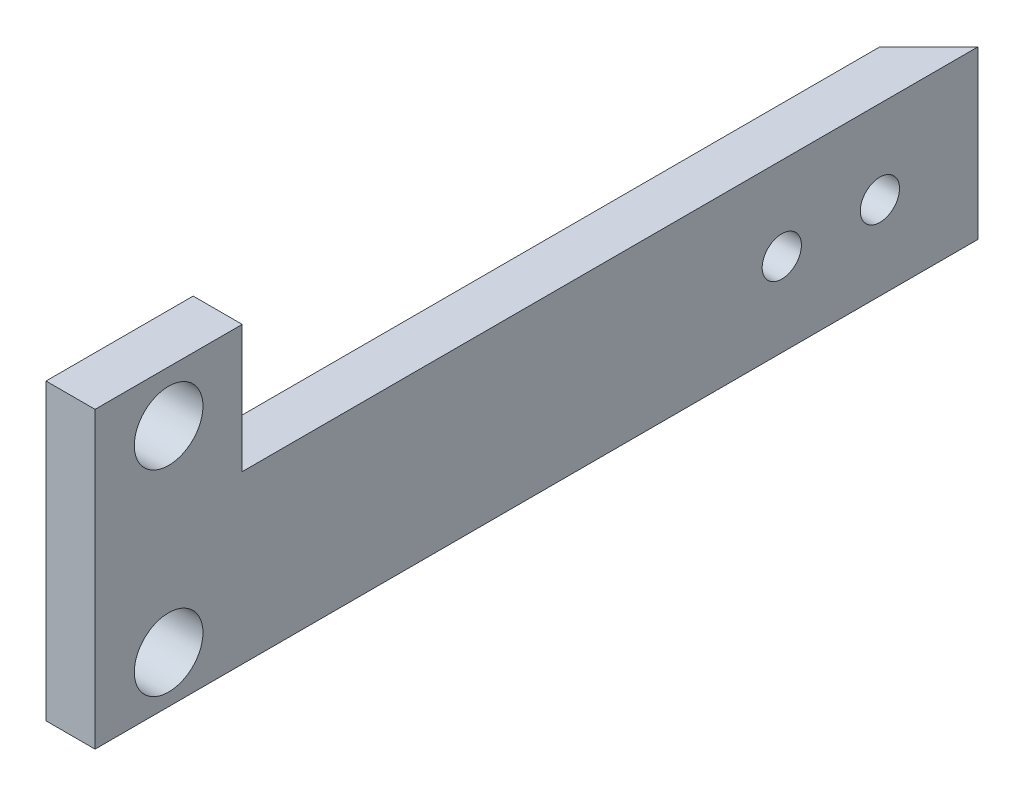
from build123d import *

# Parameters (mm, degrees)
CROQUIS1_W              = 5
CROQUIS1_H              = 30
SALIENTE_EXTRUIR1_DEPTH = 15
CROQUIS2_R              = 3.5
CORTAR_EXTRUIR1_DEPTH   = 15
CROQUIS3_W              = 5
CROQUIS3_H              = 17
SALIENTE_EXTRUIR2_DEPTH = 80
CROQUIS5_R              = 2
CORTAR_EXTRUIR3_DEPTH   = 75
CORTAR_EXTRUIR4_DEPTH   = 30


with BuildPart() as part:
    # Croquis1 → Saliente-Extruir1 (new body)
    with BuildSketch(Plane.XY):
        Rectangle(CROQUIS1_W, CROQUIS1_H)
    extrude(amount=SALIENTE_EXTRUIR1_DEPTH)

    # Croquis2 → Cortar-Extruir1 (cut)
    with BuildSketch(Plane(origin=(2.5, 0, 0), x_dir=(0, 0, -1), z_dir=(1, 0, 0))):
        with Locations((-7.5, 9.795077014)):
            Circle(CROQUIS2_R)
        with Locations((-7.5, -10.204922986)):
            Circle(CROQUIS2_R)
    extrude(amount=-CORTAR_EXTRUIR1_DEPTH, mode=Mode.SUBTRACT)

    # Croquis3 → Saliente-Extruir2 (add)
    with BuildSketch(Plane(origin=(0, 0, 0), x_dir=(-1, 0, 0), z_dir=(0, 0, -1))):
        with Locations((0, -6.5)):
            Rectangle(CROQUIS3_W, CROQUIS3_H)
    extrude(amount=SALIENTE_EXTRUIR2_DEPTH)

    # Croquis5 → Cortar-Extruir3 (cut)
    with BuildSketch(Plane(origin=(2.5, 0, 0), x_dir=(0, 0, -1), z_dir=(1, 0, 0))):
        with Locations((65, -6.5)):
            Circle(CROQUIS5_R)
        with Locations((55, -6.5)):
            Circle(CROQUIS5_R)
    extrude(amount=-CORTAR_EXTRUIR3_DEPTH, mode=Mode.SUBTRACT)

    # Croquis6 → Cortar-Extruir4 (cut)
    with BuildSketch(Plane(origin=(0, 2, 0), x_dir=(1, 0, 0), z_dir=(0, 1, 0))):
        Polygon((-2.5, 70), (2.5, 75), (2.5, 80), (-2.5, 80), align=None)
    extrude(amount=-CORTAR_EXTRUIR4_DEPTH, mode=Mode.SUBTRACT)


solid = part.part
